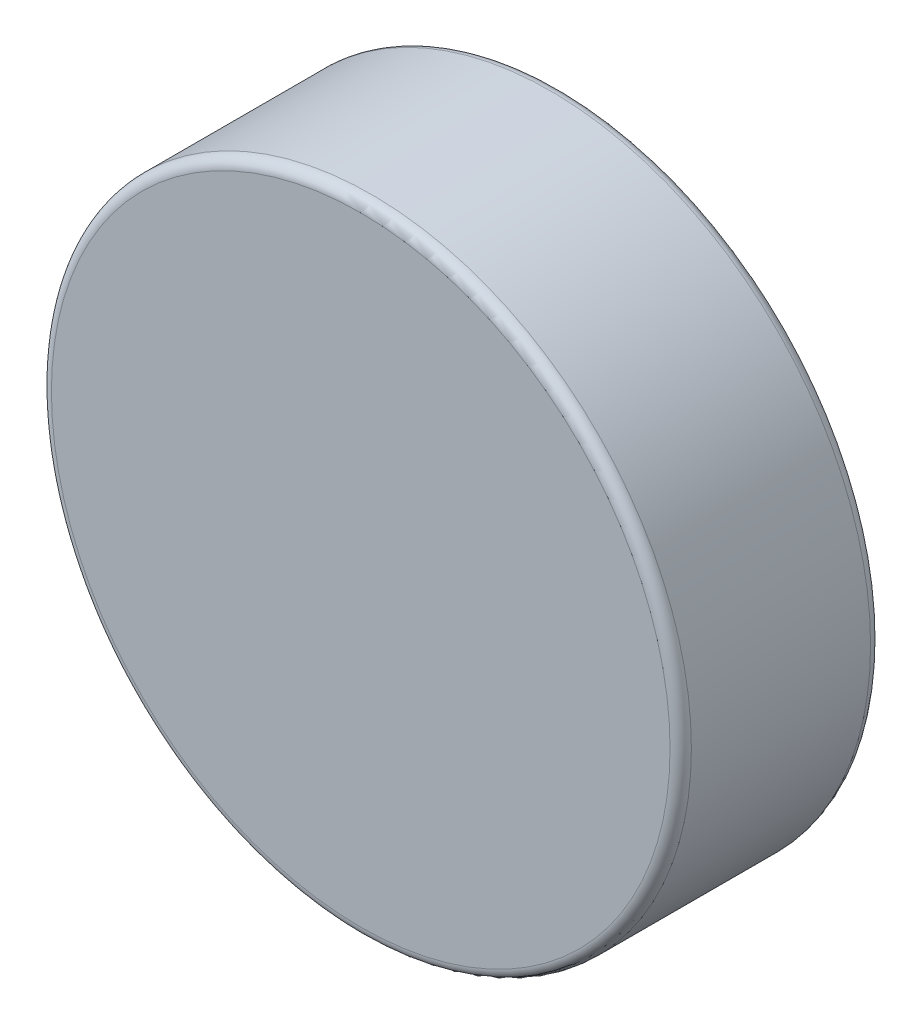
from build123d import *

# Parameters (mm, degrees)
SKETCH_1_R      = 3
EXTRUDE_1_DEPTH = 1.88
FILLET_1_R      = 0.1


with BuildPart() as part:
    # 草图1 → 凸台-拉伸1 (new body)
    with BuildSketch(Plane.XY):
        Circle(SKETCH_1_R)
    extrude(amount=EXTRUDE_1_DEPTH)

    # 圆角1
    fillet_1_edges = [part.edges().sort_by_distance(p)[0] for p in [
        (-3, 0, 0),
        (-3, 0, 1.88),
    ]]
    fillet(fillet_1_edges, radius=FILLET_1_R)


solid = part.part
